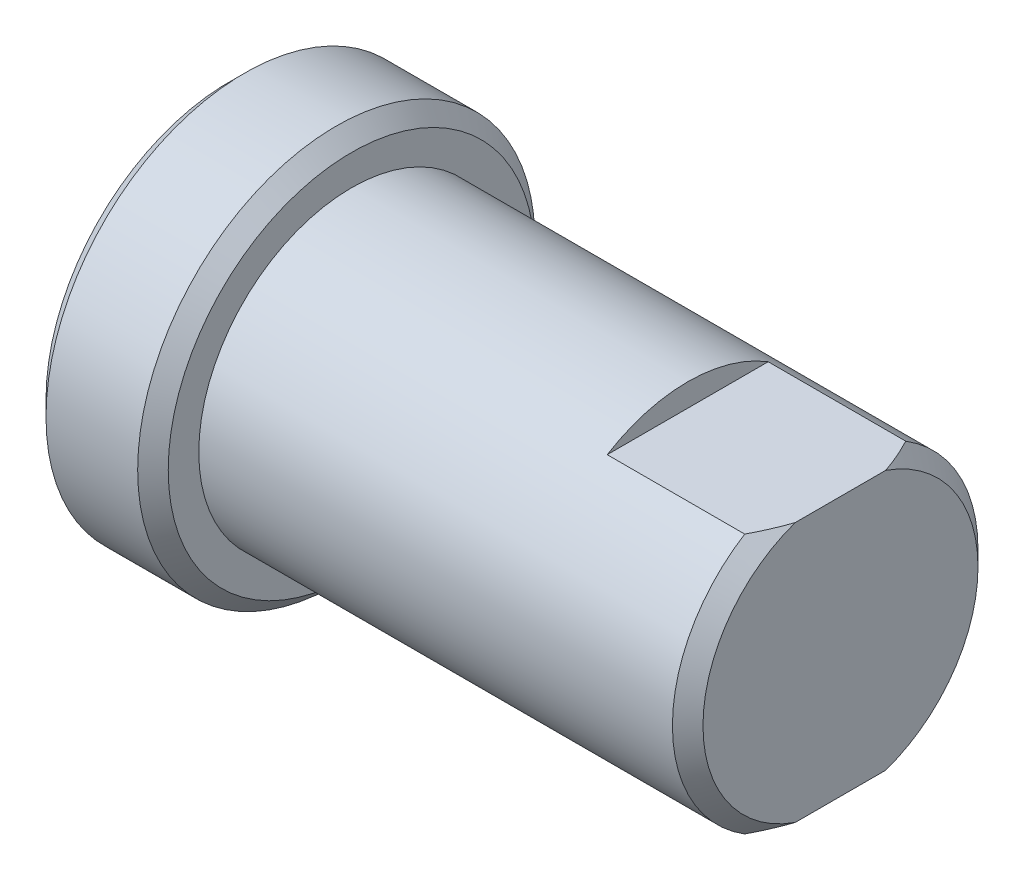
from build123d import *

# Parameters (mm, degrees)
CHAMFER1_SIZE      = 1
CUT_EXTRUDE1_DEPTH = 10


with BuildPart() as part:
    # Sketch1 → Revolve1 (revolve)
    with BuildSketch(Plane.XY, mode=Mode.PRIVATE) as revolve1_sk:
        Polygon((0, 0), (0, 13), (8, 13), (8, 10), (40, 10), (40, 0), align=None)
    revolve(revolve1_sk.sketch.rotate(Axis((0, 0, 0), (1, 0, 0)), 90), axis=Axis((0, 0, 0), (1, 0, 0)))

    # Chamfer1
    chamfer1_edges = [part.edges().sort_by_distance(p)[0] for p in [
        (40, 0, -10),
        (8, 0, -13),
        (0, 0, -13),
    ]]
    chamfer(chamfer1_edges, length=CHAMFER1_SIZE)

    # Sketch2 → Cut-Extrude1 (cut)
    with BuildSketch(Plane(origin=(40, 0, 0), x_dir=(0, 0, -1), z_dir=(1, 0, 0))):
        with BuildLine():
            ThreePointArc((5.267826876, 8.5), (0, 10), (-5.267826876, 8.5))
            Line((-5.267826876, 8.5), (-2.958039892, 8.5))
            ThreePointArc((-2.958039892, 8.5), (0, 9), (2.958039892, 8.5))
            Line((2.958039892, 8.5), (5.267826876, 8.5))
        make_face()
        with BuildLine():
            ThreePointArc((2.958039892, 8.5), (0, 9), (-2.958039892, 8.5))
            Line((-2.958039892, 8.5), (2.958039892, 8.5))
        make_face()
        with BuildLine():
            Line((-2.958039892, -8.5), (-5.267826876, -8.5))
            ThreePointArc((-5.267826876, -8.5), (0, -10), (5.267826876, -8.5))
            Line((5.267826876, -8.5), (2.958039892, -8.5))
            ThreePointArc((2.958039892, -8.5), (0, -9), (-2.958039892, -8.5))
        make_face()
        with BuildLine():
            Line((2.958039892, -8.5), (-2.958039892, -8.5))
            ThreePointArc((-2.958039892, -8.5), (0, -9), (2.958039892, -8.5))
        make_face()
    extrude(amount=-CUT_EXTRUDE1_DEPTH, mode=Mode.SUBTRACT)


solid = part.part
